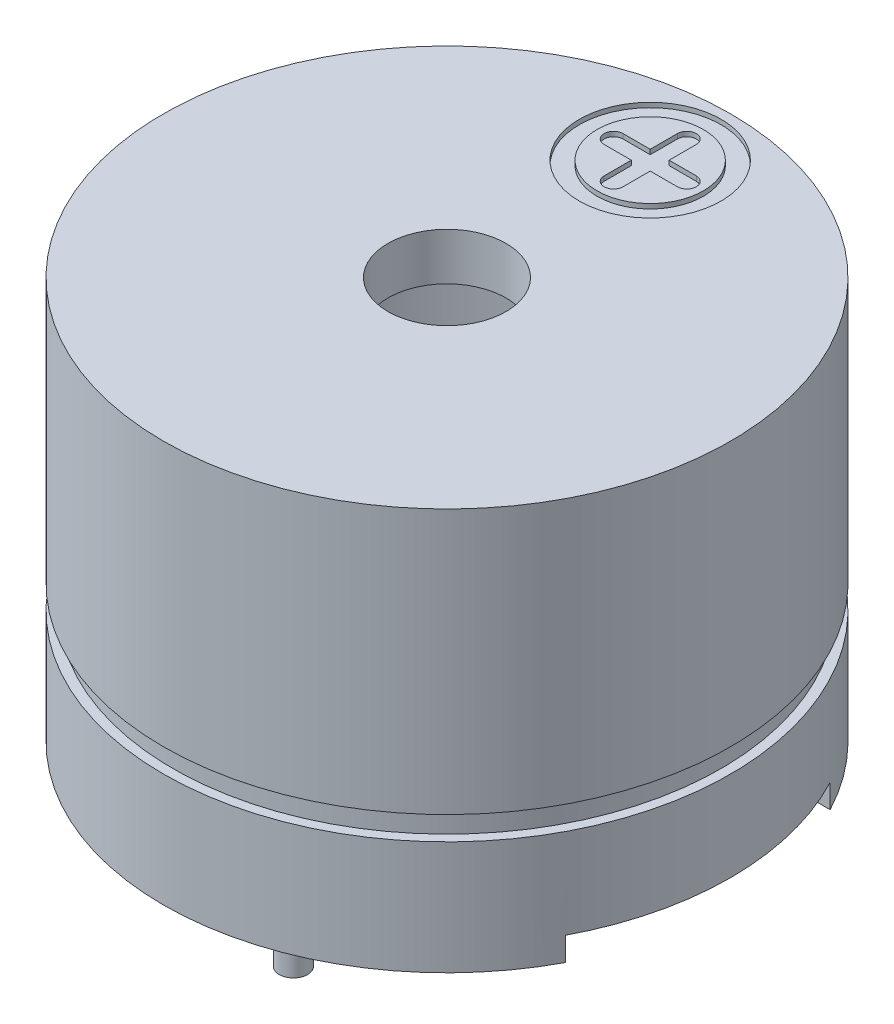
from build123d import *

# Parameters (mm, degrees)
SKETCH1_R               = 6
SKETCH1_R_2             = 1.25
BOSS_EXTRUDE1_DEPTH     = 8.5
SKETCH1_3_R             = 5
SKETCH1_3_R_2           = 3
SKETCH1_3_R_3           = 1.25
CUT_EXTRUDE1_DEPTH      = 7.5
CUT_EXTRUDE2_DEPTH      = 13.010412149
CUT_EXTRUDE2_DEPTH_BACK = 13.010412149
SKETCH2_W               = 5.6
SKETCH2_H               = 0.5
BOSS_EXTRUDE2_START     = 1
SKETCH1_4_R             = 5
SKETCH1_4_R_2           = 3
BOSS_EXTRUDE2_DEPTH     = 2
BOSS_EXTRUDE3_DEPTH     = 0.25
SKETCH4_R               = 0.3
BOSS_EXTRUDE4_DEPTH     = 0.25
SKETCH5_R               = 0.9
SKETCH5_R_2             = 0.3
BOSS_EXTRUDE5_DEPTH     = 0.05
SKETCH6_W               = 1.423745764
SKETCH6_H               = 0.5
SKETCH7_R               = 0.3
BOSS_EXTRUDE7_DEPTH     = 3.25
BOSS_EXTRUDE7_2_DEPTH   = 3.25
SKETCH8_R               = 1.5
SKETCH8_R_2             = 1.125
CUT_EXTRUDE3_DEPTH      = 0.1


with BuildPart() as part:
    # Sketch1 → Boss-Extrude1 (new body)
    with BuildSketch(Plane(origin=(0, 0, 0), x_dir=(1, 0, 0), z_dir=(0, 1, 0))):
        with Locations(Location((0, 0, 0), (0, 0, 270))):
            Circle(SKETCH1_R)
        with Locations(Location((0, 0, 0), (0, 0, 270))):
            Circle(SKETCH1_R_2, mode=Mode.SUBTRACT)
    extrude(amount=BOSS_EXTRUDE1_DEPTH)

    # Sketch1<3> → Cut-Extrude1 (cut)
    # profile 1 of 2: a face of its own
    with BuildSketch(Plane(origin=(0, 0, 0), x_dir=(1, 0, 0), z_dir=(0, 1, 0))):
        with Locations(Location((0, 0, 0), (0, 0, 270))):
            Circle(SKETCH1_3_R)
    # profile 2 of 2: a face of its own
    with BuildSketch(Plane(origin=(0, 0, 0), x_dir=(1, 0, 0), z_dir=(0, 1, 0))):
        Circle(SKETCH1_3_R_2)
        with Locations(Location((0, 0, 0), (0, 0, 270))):
            Circle(SKETCH1_3_R_3, mode=Mode.SUBTRACT)
    extrude(amount=CUT_EXTRUDE1_DEPTH, mode=Mode.SUBTRACT)

    # Sketch2 → Cut-Extrude2 (cut, two sides: drawn at the far end of the back side and taken through both)
    with BuildSketch(Plane(origin=(0, 0, 0), x_dir=(0, 0, -1), z_dir=(1, 0, 0)).offset(-CUT_EXTRUDE2_DEPTH_BACK)):
        with Locations((0, 0.25)):
            Rectangle(SKETCH2_W, SKETCH2_H)
    extrude(amount=CUT_EXTRUDE2_DEPTH + CUT_EXTRUDE2_DEPTH_BACK, mode=Mode.SUBTRACT)

    # Sketch6 → Cut-Revolve1 (revolve, cut)
    with BuildSketch(Plane(origin=(0, 0, 0), x_dir=(0, 0, -1), z_dir=(1, 0, 0))):
        with Locations((6.511872882, 2.65)):
            Rectangle(SKETCH6_W, SKETCH6_H)
    revolve(axis=Axis((0, -1000, 0), (0, 1, 0)), mode=Mode.SUBTRACT)

    # Sketch8 → Cut-Extrude3 (cut)
    # profile 1 of 2: a face of its own
    with BuildSketch(Plane(origin=(0, 8.5, 0), x_dir=(1, 0, 0), z_dir=(0, 1, 0))):
        with Locations(Location((0, 4.3, 0), (0, 0, 270))):
            Circle(SKETCH8_R)
        with Locations(Location((0, 4.3, 0), (0, 0, 270))):
            Circle(SKETCH8_R_2, mode=Mode.SUBTRACT)
    # profile 2 of 2: a face of its own
    with BuildSketch(Plane(origin=(0, 8.5, 0), x_dir=(1, 0, 0), z_dir=(0, 1, 0))):
        with BuildLine():
            ThreePointArc((0.2, 3.525), (0, 3.325), (-0.2, 3.525))
            Line((-0.2, 3.525), (-0.2, 4.1))
            Line((-0.2, 4.1), (-0.775, 4.1))
            ThreePointArc((-0.775, 4.1), (-0.975, 4.3), (-0.775, 4.5))
            Line((-0.775, 4.5), (-0.2, 4.5))
            Line((-0.2, 4.5), (-0.2, 5.075))
            ThreePointArc((-0.2, 5.075), (0, 5.275), (0.2, 5.075))
            Line((0.2, 5.075), (0.2, 4.5))
            Line((0.2, 4.5), (0.775, 4.5))
            ThreePointArc((0.775, 4.5), (0.975, 4.3), (0.775, 4.1))
            Line((0.775, 4.1), (0.2, 4.1))
            Line((0.2, 4.1), (0.2, 3.525))
        make_face()
    extrude(amount=-CUT_EXTRUDE3_DEPTH, mode=Mode.SUBTRACT)


with BuildPart() as body_2:
    # Sketch1<4> → Boss-Extrude2 (new body)
    with BuildSketch(Plane(origin=(0, 0, 0), x_dir=(1, 0, 0), z_dir=(0, 1, 0)).offset(BOSS_EXTRUDE2_START)):
        with Locations(Location((0, 0, 0), (0, 0, 270))):
            Circle(SKETCH1_4_R)
        with Locations(Location((0, 0, 0), (0, 0, 270))):
            Circle(SKETCH1_4_R_2, mode=Mode.SUBTRACT)
    extrude(amount=BOSS_EXTRUDE2_DEPTH)


with BuildPart() as body_3:
    # Sketch3 → Boss-Extrude3 (new body)
    with BuildSketch(Plane.XZ.offset(-1)):
        with BuildLine():
            Line((3.375, 1.125), (4.2, 1.125))
            ThreePointArc((4.2, 1.125), (4.341421356, 1.183578644), (4.4, 1.325))
            Line((4.4, 1.325), (4.4, 2.374868417))
            ThreePointArc((4.4, 2.374868417), (0, 5), (-4.4, 2.374868417))
            Line((-4.4, 2.374868417), (-4.4, 1.325))
            ThreePointArc((-4.4, 1.325), (-4.341421356, 1.183578644), (-4.2, 1.125))
            Line((-4.2, 1.125), (-3.375, 1.125))
            ThreePointArc((-3.375, 1.125), (-2.25, 0), (-3.375, -1.125))
            Line((-3.375, -1.125), (-4.2, -1.125))
            ThreePointArc((-4.2, -1.125), (-4.341421356, -1.183578644), (-4.4, -1.325))
            Line((-4.4, -1.325), (-4.4, -2.374868417))
            ThreePointArc((-4.4, -2.374868417), (0, -5), (4.4, -2.374868417))
            Line((4.4, -2.374868417), (4.4, -1.325))
            ThreePointArc((4.4, -1.325), (4.341421356, -1.183578644), (4.2, -1.125))
            Line((4.2, -1.125), (3.375, -1.125))
            ThreePointArc((3.375, -1.125), (2.25, 0), (3.375, 1.125))
        make_face()
    extrude(amount=BOSS_EXTRUDE3_DEPTH)


with BuildPart() as body_4:
    # Sketch4 → Boss-Extrude4 (new body)
    with BuildSketch(Plane.XZ.offset(-0.75)):
        with BuildLine():
            Line((-3.25, 3.799671038), (-3.25, 1.118033989))
            ThreePointArc((-3.25, 1.118033989), (-2.25, 0), (-3.25, -1.118033989))
            Line((-3.25, -1.118033989), (-3.25, -3.799671038))
            ThreePointArc((-3.25, -3.799671038), (0, -5), (3.25, -3.799671038))
            Line((3.25, -3.799671038), (3.25, -1.118033989))
            ThreePointArc((3.25, -1.118033989), (2.25, 0), (3.25, 1.118033989))
            Line((3.25, 1.118033989), (3.25, 3.799671038))
            ThreePointArc((3.25, 3.799671038), (0, 5), (-3.25, 3.799671038))
        make_face()
        with Locations(Location((0, 3.25, 0), (0, 0, 270))):
            Circle(SKETCH4_R, mode=Mode.SUBTRACT)
        with Locations(Location((0, -3.25, 0), (0, 0, 270))):
            Circle(SKETCH4_R, mode=Mode.SUBTRACT)
    extrude(amount=BOSS_EXTRUDE4_DEPTH)

    # Sketch5 → Boss-Extrude5 (add)
    # profile 1 of 4: a face of its own
    with BuildSketch(Plane.XZ.offset(-0.5)):
        with Locations(Location((0, 3.25, 0), (0, 0, 270))):
            Circle(SKETCH5_R)
        with Locations(Location((0, 3.25, 0), (0, 0, 270))):
            Circle(SKETCH5_R_2, mode=Mode.SUBTRACT)
    # profile 2 of 4: a face of its own
    with BuildSketch(Plane.XZ.offset(-0.5)):
        with Locations(Location((0, -3.25, 0), (0, 0, 270))):
            Circle(SKETCH5_R)
        with Locations(Location((0, -3.25, 0), (0, 0, 270))):
            Circle(SKETCH5_R_2, mode=Mode.SUBTRACT)
    # profile 3 of 4: a face of its own
    with BuildSketch(Plane.XZ.offset(-0.5)):
        with BuildLine():
            Line((-2.9, -2.7), (-2.2, -2.7))
            Line((-2.2, -2.7), (-2.2, -3.4))
            ThreePointArc((-2.2, -3.4), (-2, -3.6), (-1.8, -3.4))
            Line((-1.8, -3.4), (-1.8, -2.7))
            Line((-1.8, -2.7), (-1.1, -2.7))
            ThreePointArc((-1.1, -2.7), (-0.9, -2.5), (-1.1, -2.3))
            Line((-1.1, -2.3), (-1.8, -2.3))
            Line((-1.8, -2.3), (-1.8, -1.6))
            ThreePointArc((-1.8, -1.6), (-2, -1.4), (-2.2, -1.6))
            Line((-2.2, -1.6), (-2.2, -2.3))
            Line((-2.2, -2.3), (-2.9, -2.3))
            ThreePointArc((-2.9, -2.3), (-3.1, -2.5), (-2.9, -2.7))
        make_face()
    # profile 4 of 4: a face of its own
    with BuildSketch(Plane.XZ.offset(-0.5)):
        with BuildLine():
            Line((-2.2, 3.4), (-2.2, 1.6))
            ThreePointArc((-2.2, 1.6), (-2, 1.4), (-1.8, 1.6))
            Line((-1.8, 1.6), (-1.8, 3.4))
            ThreePointArc((-1.8, 3.4), (-2, 3.6), (-2.2, 3.4))
        make_face()
    extrude(amount=BOSS_EXTRUDE5_DEPTH)


with BuildPart() as body_5:
    # Sketch7 → Boss-Extrude7 (new body)
    with BuildSketch(Plane.XZ.offset(-0.75)):
        with Locations(Location((0, 3.25, 0), (0, 0, 90))):
            Circle(SKETCH7_R)
    extrude(amount=BOSS_EXTRUDE7_DEPTH)


with BuildPart() as body_6:
    # Sketch7 → Boss-Extrude7 2 (new body)
    with BuildSketch(Plane.XZ.offset(-0.75)):
        with Locations(Location((0, -3.25, 0), (0, 0, 90))):
            Circle(SKETCH7_R)
    extrude(amount=BOSS_EXTRUDE7_2_DEPTH)


solid = Compound([part.part, body_2.part, body_3.part, body_4.part, body_5.part, body_6.part])
